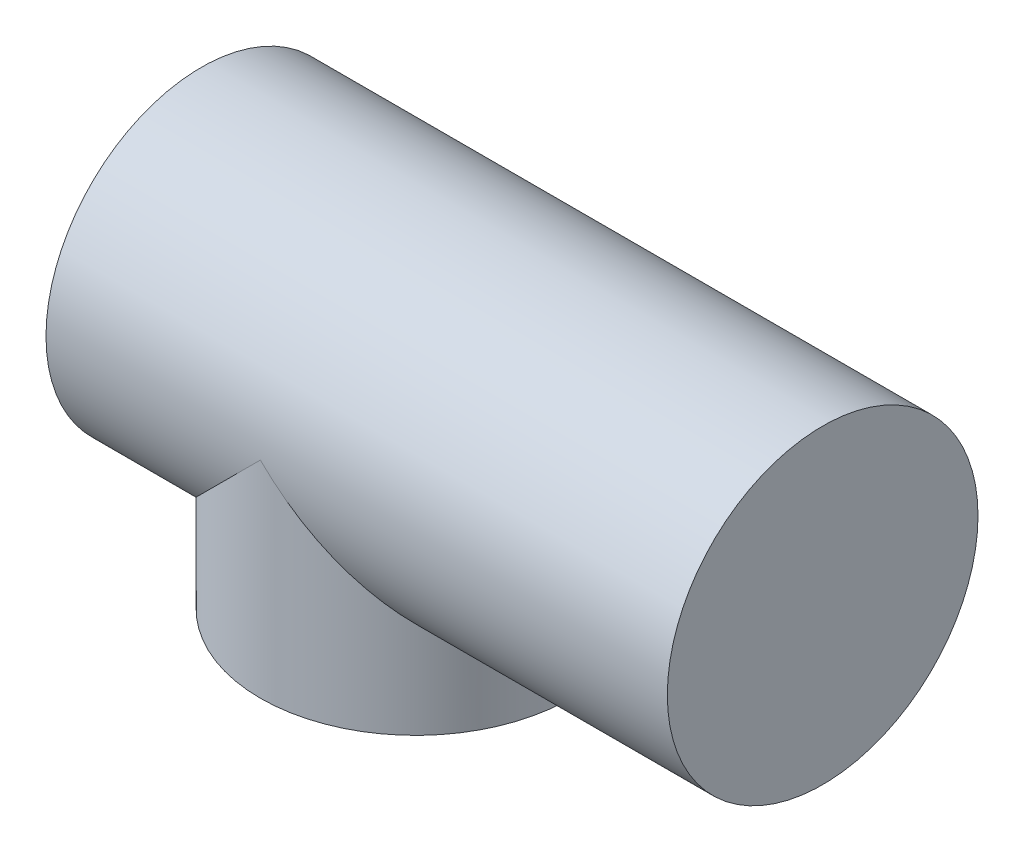
from build123d import *

# Parameters (mm, degrees)
SKETCH2_R           = 25
SKETCH4_R           = 25
BOSS_EXTRUDE1_DEPTH = 33.2


with BuildPart() as part:
    # Sweep1: sweep along a path in Sketch1
    with BuildLine(Plane.XY) as sweep1_path:
        Line((0, 0), (100, 0))
    # Sketch2 → Sweep1 (sweep)
    with BuildSketch(Plane(origin=(0, 0, 0), x_dir=(0, 0, -1), z_dir=(1, 0, 0))):
        Circle(SKETCH2_R)
    sweep(path=sweep1_path.line)

    # Sketch4 → Boss-Extrude1 (add)
    with BuildSketch(Plane(origin=(0, 0, 0), x_dir=(1, 0, 0), z_dir=(0, 1, 0))):
        with Locations(Location((34.5, 0, 0), (0, 0, 270))):
            Circle(SKETCH4_R)
    extrude(amount=-BOSS_EXTRUDE1_DEPTH)


solid = part.part
